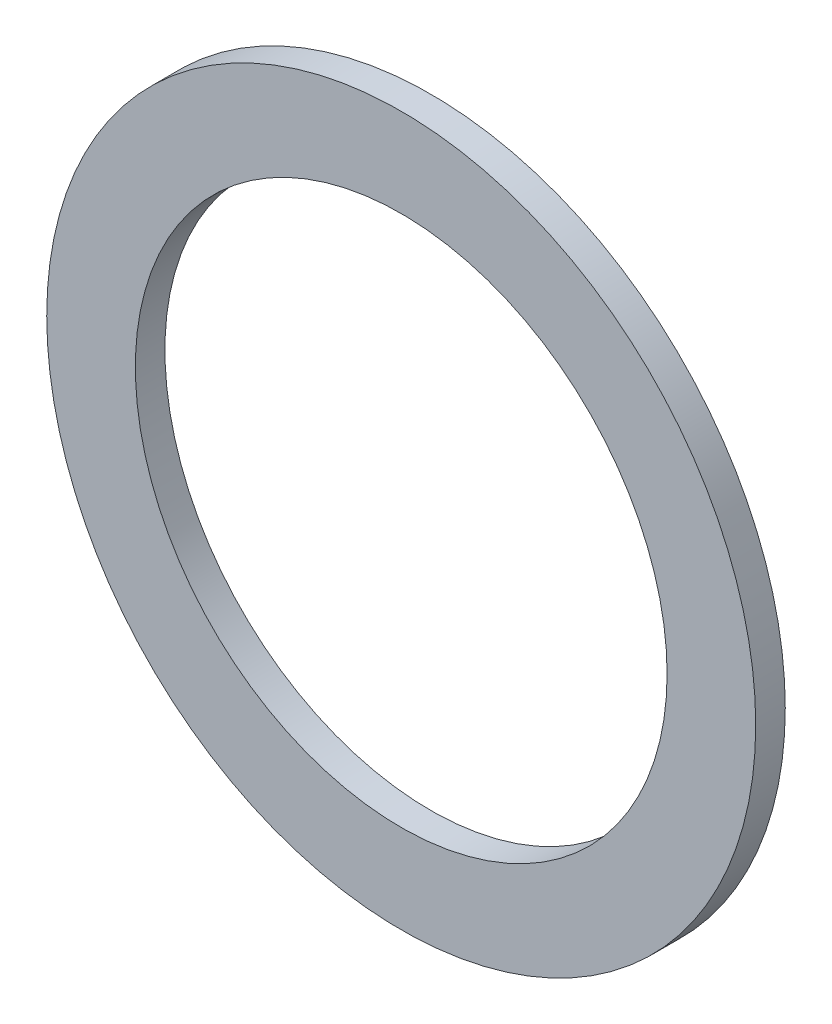
from build123d import *

# Parameters (mm, degrees)
SKETCH1_R           = 12
SKETCH1_R_2         = 9
BOSS_EXTRUDE1_DEPTH = 1


with BuildPart() as part:
    # Sketch1 → Boss-Extrude1 (new body)
    with BuildSketch(Plane.XY):
        Circle(SKETCH1_R)
        Circle(SKETCH1_R_2, mode=Mode.SUBTRACT)
    extrude(amount=BOSS_EXTRUDE1_DEPTH)


solid = part.part
